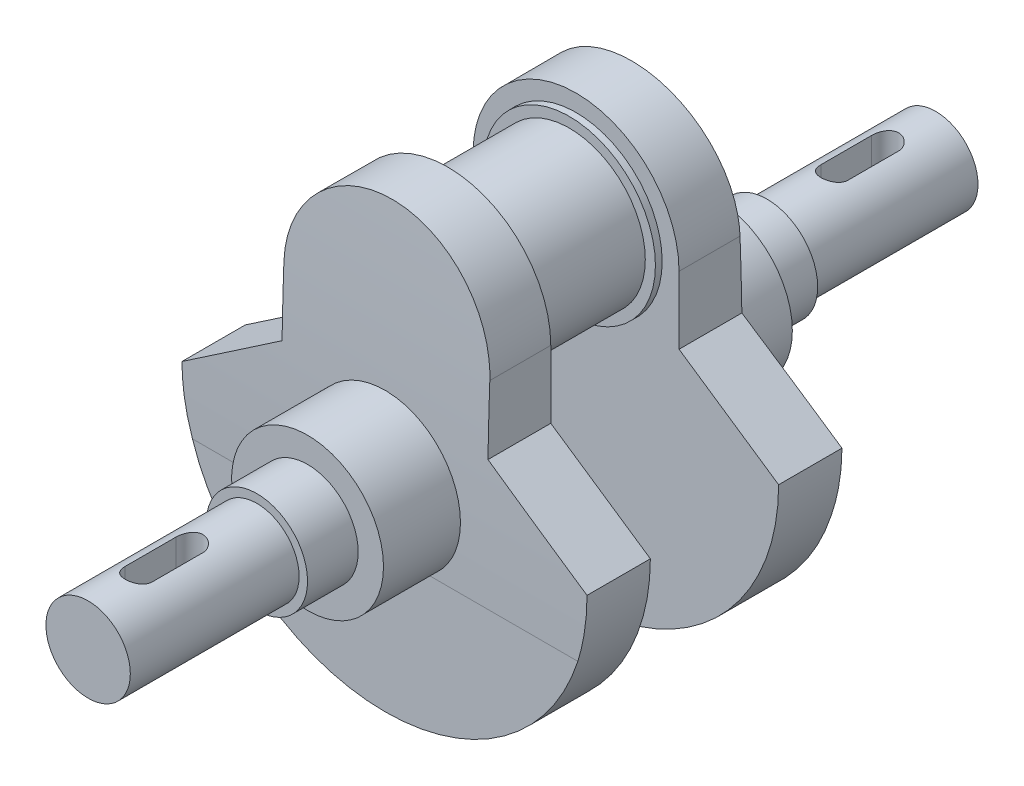
from build123d import *
from build123d.topology import SkipClean

# Parameters (mm, degrees)
SKETCH1_R                = 12.5
BOSS_EXTRUDE1_DEPTH      = 50
SKETCH2_R                = 15
BOSS_EXTRUDE2_DEPTH      = 15
SKETCH3_R                = 22.5
BOSS_EXTRUDE3_DEPTH      = 23
BOSS_EXTRUDE4_DEPTH      = 18.56
BOSS_EXTRUDE5_DEPTH      = 60
BOSS_EXTRUDE5_DEPTH_BACK = 60
CUT_EXTRUDE1_DEPTH       = 29.78
CUT_EXTRUDE2_DEPTH       = 59.56
SKETCH9_R                = 25.5
BOSS_EXTRUDE7_DEPTH      = 2
SKETCH10_R               = 22.5
BOSS_EXTRUDE8_DEPTH      = 17
CUT_EXTRUDE3_DEPTH       = 17


with BuildPart() as part:
    # Sketch1 → Boss-Extrude1 (new body)
    with BuildSketch(Plane.XY):
        Circle(SKETCH1_R)
    extrude(amount=BOSS_EXTRUDE1_DEPTH)

    # Sketch2 → Boss-Extrude2 (add)
    with BuildSketch(Plane.XY.offset(50)):
        Circle(SKETCH2_R)
    extrude(amount=BOSS_EXTRUDE2_DEPTH)

    # Sketch3 → Boss-Extrude3 (add)
    with BuildSketch(Plane.XY.offset(65)):
        Circle(SKETCH3_R)
    extrude(amount=BOSS_EXTRUDE3_DEPTH)

    # Sketch4 → Boss-Extrude4 (add)
    with BuildSketch(Plane.XY.offset(88)):
        with BuildLine():
            Line((-57.076702778, -18.5), (57.076702778, -18.5))
            ThreePointArc((57.076702778, -18.5), (0, -60), (-57.076702778, -18.5))
        make_face()
    extrude(amount=BOSS_EXTRUDE4_DEPTH)

    # Sketch5 → Boss-Extrude5 (add, two sides: drawn at the far end of the back side and taken through both)
    with BuildSketch(Plane(origin=(0, 0, 0), x_dir=(0, 0, -1), z_dir=(1, 0, 0)).offset(-BOSS_EXTRUDE5_DEPTH_BACK)):
        with BuildLine():
            Line((-106.56, -18.5), (-106.56, 70.5))
            Line((-106.56, 70.5), (-90.067236991, 70.5))
            ThreePointArc((-90.067236991, 70.5), (-88.075811945, 26.022247339), (-88, -18.5))
            Line((-88, -18.5), (-106.56, -18.5))
        make_face()
    extrude(amount=BOSS_EXTRUDE5_DEPTH + BOSS_EXTRUDE5_DEPTH_BACK)

    # Sketch7 → Cut-Extrude1 (cut, symmetric)
    with SkipClean():  # the faces are left unmerged after this step: merging them gives an invalid solid
        with BuildSketch(Plane(origin=(0, 0, 88), x_dir=(-1, 0, 0), z_dir=(0, 0, -1))):
            with BuildLine():
                Line((-60, 0), (-60, -18.5))
                Line((-60, -18.5), (-57.076702778, -18.5))
                ThreePointArc((-57.076702778, -18.5), (-59.264669773, -9.364769974), (-60, 0))
            make_face()
            with BuildLine():
                Line((60, 0), (60, -18.5))
                Line((60, -18.5), (57.076702778, -18.5))
                ThreePointArc((57.076702778, -18.5), (59.264669773, -9.364769974), (60, 0))
            make_face()
        extrude(amount=CUT_EXTRUDE1_DEPTH, both=True, mode=Mode.SUBTRACT)

    # Sketch8 → Cut-Extrude2 (cut)
    with SkipClean():  # the faces are left unmerged after this step: merging them gives an invalid solid
        with BuildSketch(Plane.XY.offset(106.56)):
            with BuildLine():
                Line((-60, 70.5), (-60, 0))
                Line((-60, 0), (-30.499999847, 20.003051391))
                Line((-30.499999847, 20.003051391), (-30.499999847, 40.003051391))
                ThreePointArc((-30.499999847, 40.003051391), (-21.565677894, 61.567835705), (2.15e-07, 70.5))
                Line((2.15e-07, 70.5), (-60, 70.5))
            make_face()
            with BuildLine():
                Line((60, 70.5), (2.15e-07, 70.5))
                ThreePointArc((2.15e-07, 70.5), (21.565678046, 61.567835553), (30.499999847, 40.003051391))
                Line((30.499999847, 40.003051391), (30.499999847, 20.003051391))
                Line((30.499999847, 20.003051391), (60, 0))
                Line((60, 0), (60, 70.5))
            make_face()
        extrude(amount=-CUT_EXTRUDE2_DEPTH, mode=Mode.SUBTRACT)

    # Sketch9 → Boss-Extrude7 (add)
    with SkipClean():  # the faces are left unmerged after this step: merging them gives an invalid solid
        with BuildSketch(Plane.XY.offset(106.56)):
            with Locations((0, 40)):
                Circle(SKETCH9_R)
        extrude(amount=BOSS_EXTRUDE7_DEPTH)

    # Sketch10 → Boss-Extrude8 (add)
    with SkipClean():  # the faces are left unmerged after this step: merging them gives an invalid solid
        with BuildSketch(Plane.XY.offset(108.56)):
            with Locations((0, 40)):
                Circle(SKETCH10_R)
        extrude(amount=BOSS_EXTRUDE8_DEPTH)

    # Sketch11 → Cut-Extrude3 (cut)
    with SkipClean():  # the faces are left unmerged after this step: merging them gives an invalid solid
        with BuildSketch(Plane(origin=(0, 0, 0), x_dir=(1, 0, 0), z_dir=(0, 1, 0))):
            with BuildLine():
                Line((4, -15), (4, -30))
                ThreePointArc((4, -30), (0, -34), (-4, -30))
                Line((-4, -30), (-4, -15))
                ThreePointArc((-4, -15), (0, -11), (4, -15))
            make_face()
        extrude(amount=CUT_EXTRUDE3_DEPTH, mode=Mode.SUBTRACT)

    # Mirror1: part across plane


with BuildPart() as part_1:
    with SkipClean():  # the faces are left unmerged after this step: merging them gives an invalid solid
        add(part.part)
        add(part.part.mirror(Plane(origin=(0, 40, 125.56), x_dir=(1, 0, 0), z_dir=(0, 0, 1))))


solid = part_1.part
